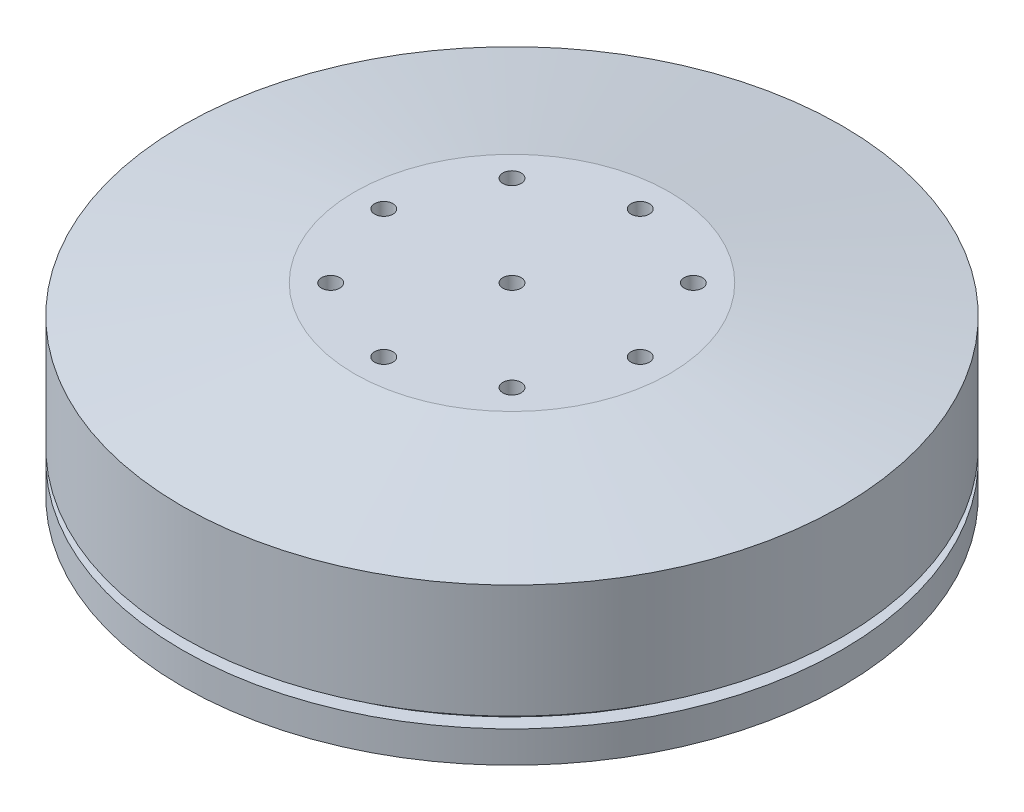
from build123d import *

# Parameters (mm, degrees)
TAP_DRILL_FOR_M3X0_5_TAP1_D     = 2.5
TAP_DRILL_FOR_M3X0_5_TAP1_DEPTH = 6
TAP_DRILL_FOR_M3X0_5_TAP1_TIP   = 0.751075774
TAP_DRILL_FOR_M3X0_5_TAP2_D     = 2.5
TAP_DRILL_FOR_M3X0_5_TAP2_DEPTH = 6
TAP_DRILL_FOR_M3X0_5_TAP2_TIP   = 0.751075774


with BuildPart() as part:
    # Sketch1 → Revolve1 (revolve)
    with BuildSketch(Plane.XY):
        Polygon((0, 0), (0, 33.5), (-21.5, 33.5), (-45, 29.6), (-45, 14.1), (-43, 14.1), (-43, 12.6), (-45, 12.6), (-45, 8.3), (-26.5, 5.6), (-26.5, 0), align=None)
    revolve(axis=Axis((0, 0, 0), (0, -1, 0)))

    # Tap Drill for M3x0.5 Tap1
    with Locations(Plane(origin=(0, 33.5, 0), x_dir=(1, 0, 0), z_dir=(0, 1, 0))):
        with Locations((0, 17.5), (12.374368671, 12.374368671), (17.5, 0), (12.374368671, -12.374368671), (0, -17.5), (-12.374368671, -12.374368671), (-17.5, 0), (-12.374368671, 12.374368671), (0, 0)):
            Hole(TAP_DRILL_FOR_M3X0_5_TAP1_D / 2, depth=TAP_DRILL_FOR_M3X0_5_TAP1_DEPTH)
            with Locations((0, 0, -(TAP_DRILL_FOR_M3X0_5_TAP1_DEPTH + TAP_DRILL_FOR_M3X0_5_TAP1_TIP / 2))):  # 118° drill point
                Cone(0, TAP_DRILL_FOR_M3X0_5_TAP1_D / 2, TAP_DRILL_FOR_M3X0_5_TAP1_TIP, mode=Mode.SUBTRACT)

    # Tap Drill for M3x0.5 Tap2
    with Locations(Plane(origin=(0, 0, 0), x_dir=(-1, 0, 0), z_dir=(0, -1, 0))):
        with Locations((0, 15), (15, 0), (0, -15), (-15, 0), (0, 0)):
            Hole(TAP_DRILL_FOR_M3X0_5_TAP2_D / 2, depth=TAP_DRILL_FOR_M3X0_5_TAP2_DEPTH)
            with Locations((0, 0, -(TAP_DRILL_FOR_M3X0_5_TAP2_DEPTH + TAP_DRILL_FOR_M3X0_5_TAP2_TIP / 2))):  # 118° drill point
                Cone(0, TAP_DRILL_FOR_M3X0_5_TAP2_D / 2, TAP_DRILL_FOR_M3X0_5_TAP2_TIP, mode=Mode.SUBTRACT)


solid = part.part
